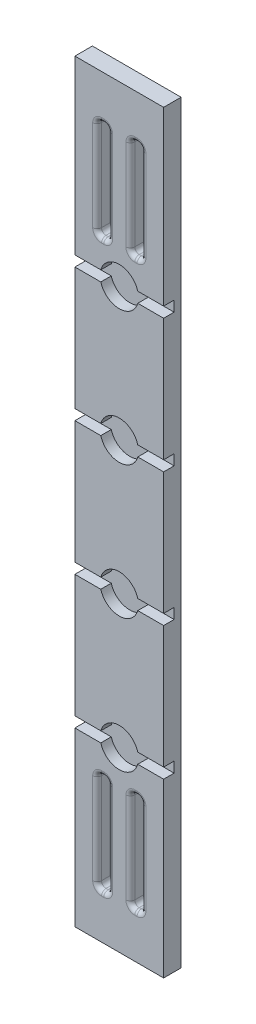
from build123d import *

# Parameters (mm, degrees)
SKETCH1_W           = 25.4
SKETCH1_H           = 215.9
SKETCH1_W_2         = 3.175
SKETCH1_H_2         = 28.575
BOSS_EXTRUDE1_DEPTH = 5
FILLET1_R           = 1.27
CUT_EXTRUDE1_DEPTH  = 3.000000096


with BuildPart() as part:
    # Sketch1 → Boss-Extrude1 (new body)
    with BuildSketch(Plane.XY):
        with Locations((12.7, 107.95)):
            Rectangle(SKETCH1_W, SKETCH1_H)
        with Locations((7.9375, 188.9125)):
            Rectangle(SKETCH1_W_2, SKETCH1_H_2, mode=Mode.SUBTRACT)
        with Locations((17.4625, 188.9125)):
            Rectangle(SKETCH1_W_2, SKETCH1_H_2, mode=Mode.SUBTRACT)
        with Locations((7.9375, 26.9875)):
            Rectangle(SKETCH1_W_2, SKETCH1_H_2, mode=Mode.SUBTRACT)
        with Locations((17.4625, 26.9875)):
            Rectangle(SKETCH1_W_2, SKETCH1_H_2, mode=Mode.SUBTRACT)
    extrude(amount=BOSS_EXTRUDE1_DEPTH)

    # Fillet1
    fillet1_edges = [part.edges().sort_by_distance(p)[0] for p in [
        (6.35, 188.9125, 0),
        (6.35, 203.2, 2.5),
        (7.9375, 174.625, 0),
        (6.35, 174.625, 2.5),
        (9.525, 188.9125, 0),
        (9.525, 174.625, 2.5),
        (7.9375, 203.2, 0),
        (9.525, 203.2, 2.5),
        (6.35, 188.9125, 5),
        (7.9375, 174.625, 5),
        (9.525, 188.9125, 5),
        (7.9375, 203.2, 5),
        (15.875, 188.9125, 0),
        (15.875, 203.2, 2.5),
        (17.4625, 174.625, 0),
        (15.875, 174.625, 2.5),
        (19.05, 188.9125, 0),
        (19.05, 174.625, 2.5),
        (17.4625, 203.2, 0),
        (19.05, 203.2, 2.5),
        (15.875, 188.9125, 5),
        (17.4625, 174.625, 5),
        (19.05, 188.9125, 5),
        (17.4625, 203.2, 5),
        (15.875, 26.9875, 0),
        (15.875, 41.275, 2.5),
        (17.4625, 12.7, 0),
        (15.875, 12.7, 2.5),
        (19.05, 26.9875, 0),
        (19.05, 12.7, 2.5),
        (17.4625, 41.275, 0),
        (19.05, 41.275, 2.5),
        (15.875, 26.9875, 5),
        (17.4625, 12.7, 5),
        (19.05, 26.9875, 5),
        (17.4625, 41.275, 5),
        (6.35, 26.9875, 0),
        (6.35, 41.275, 2.5),
        (7.9375, 12.7, 0),
        (6.35, 12.7, 2.5),
        (9.525, 26.9875, 0),
        (9.525, 12.7, 2.5),
        (7.9375, 41.275, 0),
        (9.525, 41.275, 2.5),
        (6.35, 26.9875, 5),
        (7.9375, 12.7, 5),
        (9.525, 26.9875, 5),
        (7.9375, 41.275, 5),
    ]]
    fillet(fillet1_edges, radius=FILLET1_R)

    # Sketch2 → Cut-Extrude1 (cut)
    with BuildSketch(Plane.XY.offset(5)):
        with BuildLine():
            Line((17.991502622, 166.6), (25.4, 166.6))
            Line((25.4, 166.6), (25.4, 163.6))
            Line((25.4, 163.6), (17.991502622, 163.6))
            ThreePointArc((17.991502622, 163.6), (12.7, 159.6), (7.408497378, 163.6))
            Line((7.408497378, 163.6), (0, 163.6))
            Line((0, 163.6), (0, 166.6))
            Line((0, 166.6), (7.408497378, 166.6))
            ThreePointArc((7.408497378, 166.6), (12.7, 170.6), (17.991502622, 166.6))
        make_face()
        with BuildLine():
            Line((17.991502622, 128.5), (25.4, 128.5))
            Line((25.4, 128.5), (25.4, 125.5))
            Line((25.4, 125.5), (17.991502622, 125.5))
            ThreePointArc((17.991502622, 125.5), (12.7, 121.5), (7.408497378, 125.5))
            Line((7.408497378, 125.5), (0, 125.5))
            Line((0, 125.5), (0, 128.5))
            Line((0, 128.5), (7.408497378, 128.5))
            ThreePointArc((7.408497378, 128.5), (12.7, 132.5), (17.991502622, 128.5))
        make_face()
        with BuildLine():
            Line((17.991502622, 90.4), (25.4, 90.4))
            Line((25.4, 90.4), (25.4, 87.4))
            Line((25.4, 87.4), (17.991502622, 87.4))
            ThreePointArc((17.991502622, 87.4), (12.7, 83.4), (7.408497378, 87.4))
            Line((7.408497378, 87.4), (0, 87.4))
            Line((0, 87.4), (0, 90.4))
            Line((0, 90.4), (7.408497378, 90.4))
            ThreePointArc((7.408497378, 90.4), (12.7, 94.4), (17.991502622, 90.4))
        make_face()
        with BuildLine():
            Line((17.991502622, 52.3), (25.4, 52.3))
            Line((25.4, 52.3), (25.4, 49.3))
            Line((25.4, 49.3), (17.991502622, 49.3))
            ThreePointArc((17.991502622, 49.3), (12.7, 45.3), (7.408497378, 49.3))
            Line((7.408497378, 49.3), (0, 49.3))
            Line((0, 49.3), (0, 52.3))
            Line((0, 52.3), (7.408497378, 52.3))
            ThreePointArc((7.408497378, 52.3), (12.7, 56.3), (17.991502622, 52.3))
        make_face()
    extrude(amount=-CUT_EXTRUDE1_DEPTH, mode=Mode.SUBTRACT)


solid = part.part
